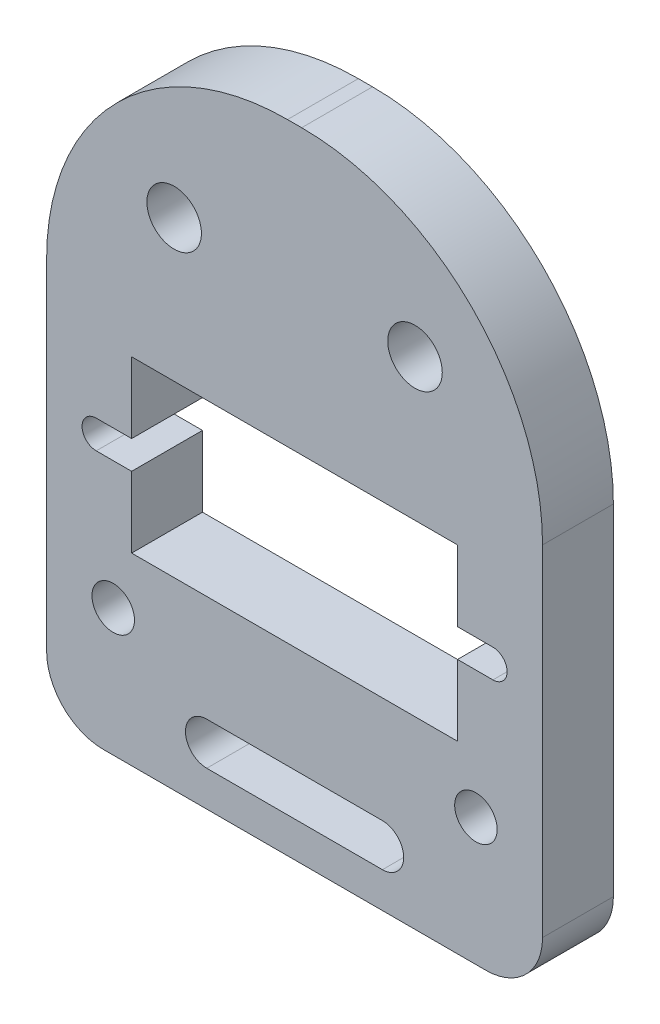
from build123d import *

# Parameters (mm, degrees)
ESQUISSE1_R        = 1.925
ESQUISSE1_R_2      = 1.5
BOSS_EXTRU_1_DEPTH = 5


with BuildPart() as part:
    # Esquisse1 → Boss.-Extru.1 (new body)
    with BuildSketch(Plane.XY):
        with BuildLine():
            Line((13.5, -22.5), (-13.5, -22.5))
            ThreePointArc((-13.5, -22.5), (-16.328427125, -21.328427125), (-17.5, -18.5))
            Line((-17.5, -18.5), (-17.5, 5.5))
            ThreePointArc((-17.5, 5.5), (-12.52081528, 17.52081528), (-0.5, 22.5))
            Line((-0.5, 22.5), (0.5, 22.5))
            ThreePointArc((0.5, 22.5), (12.52081528, 17.52081528), (17.5, 5.5))
            Line((17.5, 5.5), (17.5, -18.5))
            ThreePointArc((17.5, -18.5), (16.328427125, -21.328427125), (13.5, -22.5))
        make_face()
        with Locations((8.5, 12.5)):
            Circle(ESQUISSE1_R, mode=Mode.SUBTRACT)
        with Locations((-8.5, 12.5)):
            Circle(ESQUISSE1_R, mode=Mode.SUBTRACT)
        with Locations((-12.8, -13.5)):
            Circle(ESQUISSE1_R_2, mode=Mode.SUBTRACT)
        with Locations((12.8, -13.5)):
            Circle(ESQUISSE1_R_2, mode=Mode.SUBTRACT)
        with BuildLine():
            Line((-6.2, -20), (6.2, -20))
            ThreePointArc((6.2, -20), (7.260660172, -19.560660172), (7.7, -18.5))
            ThreePointArc((7.7, -18.5), (7.260660172, -17.439339828), (6.2, -17))
            Line((6.2, -17), (-6.2, -17))
            ThreePointArc((-6.2, -17), (-7.260660172, -17.439339828), (-7.7, -18.5))
            ThreePointArc((-7.7, -18.5), (-7.260660172, -19.560660172), (-6.2, -20))
        make_face(mode=Mode.SUBTRACT)
        with BuildLine():
            Line((-11.5, -9.5), (11.5, -9.5))
            Line((11.5, -9.5), (11.5, -4.5))
            Line((11.5, -4.5), (14, -4.5))
            ThreePointArc((14, -4.5), (15, -3.5), (14, -2.5))
            Line((14, -2.5), (11.5, -2.5))
            Line((11.5, -2.5), (11.5, 2.5))
            Line((11.5, 2.5), (-11.5, 2.5))
            Line((-11.5, 2.5), (-11.5, -2.5))
            Line((-11.5, -2.5), (-14, -2.5))
            ThreePointArc((-14, -2.5), (-15, -3.5), (-14, -4.5))
            Line((-14, -4.5), (-11.5, -4.5))
            Line((-11.5, -4.5), (-11.5, -9.5))
        make_face(mode=Mode.SUBTRACT)
    extrude(amount=BOSS_EXTRU_1_DEPTH)


solid = part.part
